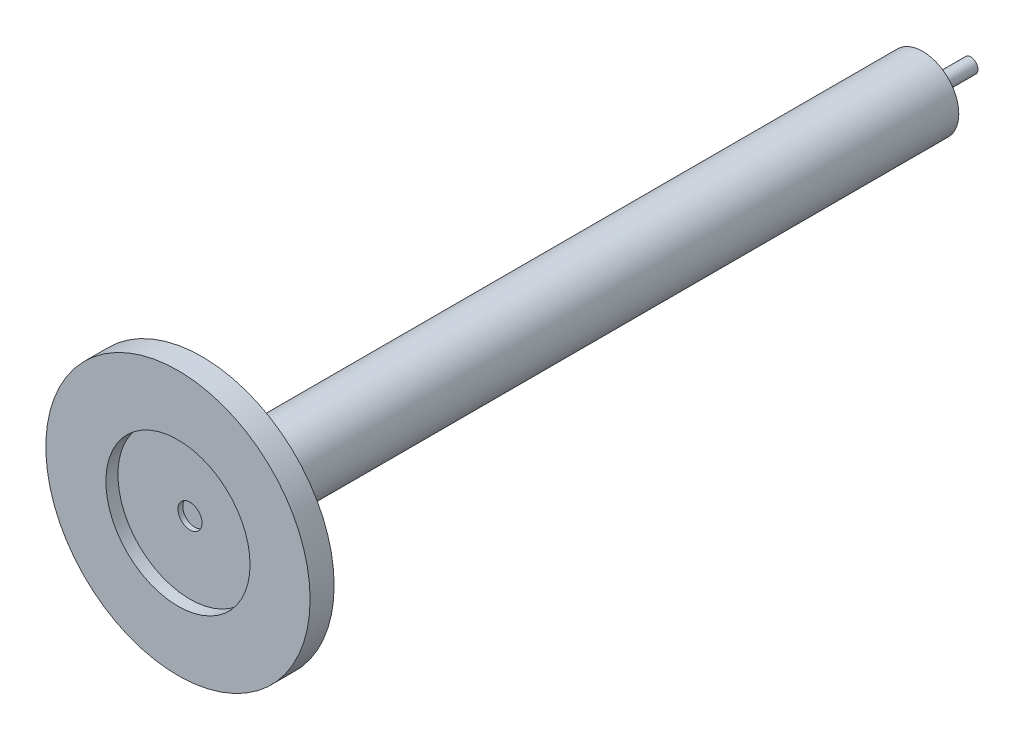
from build123d import *

# Parameters (mm, degrees)
SKETCH1_R           = 139.7
BOSS_EXTRUDE1_DEPTH = 25.4
SKETCH3_R           = 38.1
BOSS_EXTRUDE2_DEPTH = 762
SKETCH5_R           = 7.62
BOSS_EXTRUDE3_DEPTH = 50.8
SKETCH7_R           = 76.2
CUT_EXTRUDE1_DEPTH  = 12.7
SKETCH9_R           = 12.7
CUT_EXTRUDE3_DEPTH  = 5.08


with BuildPart() as part:
    # Sketch1 → Boss-Extrude1 (new body)
    with BuildSketch(Plane.XY):
        Circle(SKETCH1_R)
    extrude(amount=BOSS_EXTRUDE1_DEPTH)

    # Sketch3 → Boss-Extrude2 (add)
    with BuildSketch(Plane(origin=(0, 0, 0), x_dir=(-1, 0, 0), z_dir=(0, 0, -1))):
        with Locations(Location((0, 0, 0), (0, 0, 180))):
            Circle(SKETCH3_R)
    extrude(amount=BOSS_EXTRUDE2_DEPTH)

    # Sketch5 → Boss-Extrude3 (add)
    with BuildSketch(Plane(origin=(0, 0, -762), x_dir=(-1, 0, 0), z_dir=(0, 0, -1))):
        Circle(SKETCH5_R)
    extrude(amount=BOSS_EXTRUDE3_DEPTH)

    # Sketch7 → Cut-Extrude1 (cut)
    with BuildSketch(Plane.XY.offset(25.4)):
        Circle(SKETCH7_R)
    extrude(amount=-CUT_EXTRUDE1_DEPTH, mode=Mode.SUBTRACT)

    # Sketch9 → Cut-Extrude3 (cut)
    with BuildSketch(Plane.XY.offset(12.7)):
        Circle(SKETCH9_R)
    extrude(amount=-CUT_EXTRUDE3_DEPTH, mode=Mode.SUBTRACT)


solid = part.part
